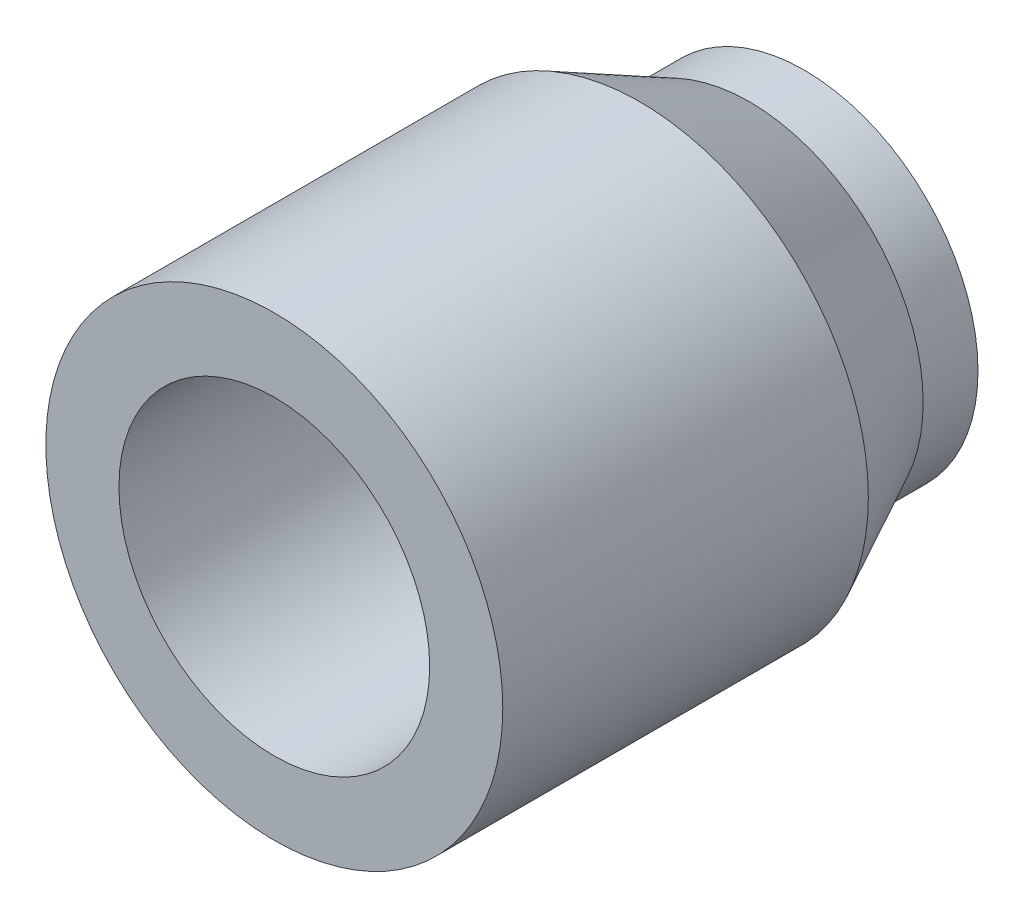
from build123d import *

# Parameters (mm, degrees)
SKETCH1_R           = 4.75
SKETCH2_R           = 6.25
SKETCH1_68_R        = 2.75
SKETCH2_53_R        = 4.25
SKETCH1_69_R        = 4.75
SKETCH1_69_R_2      = 2.75
BOSS_EXTRUDE1_DEPTH = 1.5
SKETCH2_54_R        = 6.25
SKETCH2_54_R_2      = 4.25
BOSS_EXTRUDE2_DEPTH = 10


with BuildPart() as part:
    # Sketch1 → Loft2 section 0
    with BuildSketch(Plane.XY):
        Circle(SKETCH1_R)
    # Sketch2 → Loft2 section 1
    with BuildSketch(Plane.XY.offset(3)):
        Circle(SKETCH2_R)
    loft()

    # Sketch1<68> → Cut-Loft1 section 0
    with BuildSketch(Plane.XY):
        Circle(SKETCH1_68_R)
    # Sketch2<53> → Cut-Loft1 section 1
    with BuildSketch(Plane.XY.offset(3)):
        Circle(SKETCH2_53_R)
    loft(mode=Mode.SUBTRACT)

    # Sketch1<69> → Boss-Extrude1 (add)
    with BuildSketch(Plane.XY):
        Circle(SKETCH1_69_R)
        Circle(SKETCH1_69_R_2, mode=Mode.SUBTRACT)
    extrude(amount=-BOSS_EXTRUDE1_DEPTH)

    # Sketch2<54> → Boss-Extrude2 (add)
    with BuildSketch(Plane.XY.offset(3)):
        Circle(SKETCH2_54_R)
        Circle(SKETCH2_54_R_2, mode=Mode.SUBTRACT)
    extrude(amount=BOSS_EXTRUDE2_DEPTH)


solid = part.part
